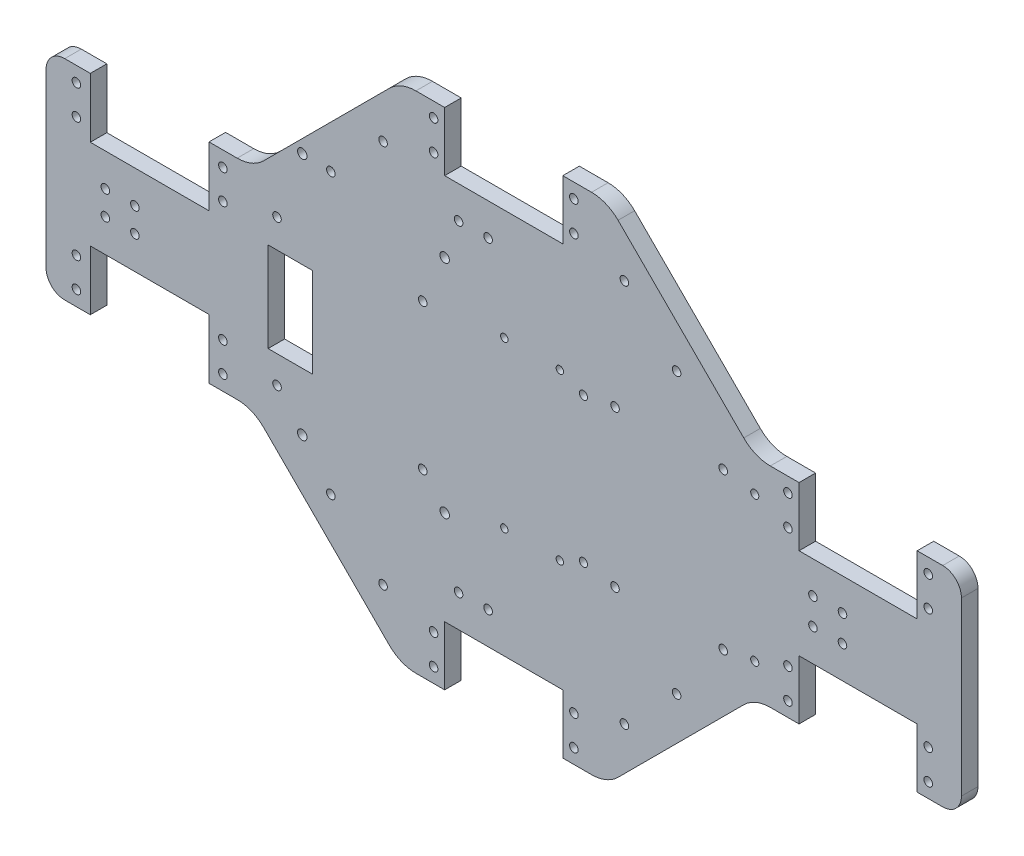
from build123d import *

# Parameters (mm, degrees)
BOSS_EXTRU_1_DEPTH       = 5.6
ENL_V_MAT_EXTRU_1_REACH  = 323.597
ESQUISSE2_W              = 40.2
ESQUISSE2_H              = 20.2
ENL_V_MAT_EXTRU_2_REACH  = 323.597
ESQUISSE3_R              = 1.45
SKETCH2_W                = 40
SKETCH2_H                = 20
CUT_EXTRUDE2_DEPTH       = 322.596828343
SKETCH5_R                = 1.45
CUT_EXTRUDE4_DEPTH       = 322.596828343
ESQUISSE4_R              = 1.375
ENL_V_MAT_EXTRU_4_DEPTH  = 322.596828343
ESQUISSE6_R              = 1.45
ENL_V_MAT_EXTRU_6_DEPTH  = 322.596828343
ESQUISSE8_R              = 1.25
ENL_V_MAT_EXTRU_7_DEPTH  = 322.596828343
ESQUISSE9_R              = 1.6
ENL_V_MAT_EXTRU_8_DEPTH  = 322.596828343
SKETCH6_W                = 15
SKETCH6_H                = 30.4
CUT_EXTRUDE5_DEPTH       = 10
ESQUISSE12_R             = 1.45
ENL_V_MAT_EXTRU_11_DEPTH = 322.596828343
FILLET1_R                = 6.35
FILLET2_R                = 12.7
SKETCH8_R                = 1.45
CUT_EXTRUDE7_DEPTH       = 322.596828343


with BuildPart() as part:
    # Esquisse1 → Boss.-Extru.1 (new body)
    with BuildSketch(Plane.XY):
        Polygon((70, -35.4), (120, -85.4), (190, -85.4), (240, -35.4), (310, -35.4), (310, 0), (25.838605695, 0), (0, 0), (0, -35.4), align=None)
    boss_extru_1 = extrude(amount=BOSS_EXTRU_1_DEPTH)

    # Esquisse2 → Enlèv. mat.-Extru.1 (cut, up to next)
    with BuildSketch(Plane.XY.offset(5.6), mode=Mode.PRIVATE) as enl_v_mat_extru_1_sk1:
        with Locations((35.1, -25.3)):
            Rectangle(ESQUISSE2_W, ESQUISSE2_H)
    enl_v_mat_extru_1_tool1 = extrude(enl_v_mat_extru_1_sk1.sketch, amount=-ENL_V_MAT_EXTRU_1_REACH, mode=Mode.PRIVATE) & part.part
    enl_v_mat_extru_1 = enl_v_mat_extru_1_tool1.solids().sort_by_distance((35.1, -25.3, 5.6))[0]
    add(enl_v_mat_extru_1, mode=Mode.SUBTRACT)

    # Esquisse3 → Enlèv. mat.-Extru.2 (cut, up to next)
    with BuildSketch(Plane.XY.offset(5.6), mode=Mode.PRIVATE) as enl_v_mat_extru_2_sk1:
        with Locations((10.3, -30.3)):
            Circle(ESQUISSE3_R)
    enl_v_mat_extru_2_tool1 = extrude(enl_v_mat_extru_2_sk1.sketch, amount=-ENL_V_MAT_EXTRU_2_REACH, mode=Mode.PRIVATE) & part.part
    # Esquisse3 → Enlèv. mat.-Extru.2 (cut, up to next)
    with BuildSketch(Plane.XY.offset(5.6), mode=Mode.PRIVATE) as enl_v_mat_extru_2_sk2:
        with Locations((59.9, -30.3)):
            Circle(ESQUISSE3_R)
    enl_v_mat_extru_2_tool2 = extrude(enl_v_mat_extru_2_sk2.sketch, amount=-ENL_V_MAT_EXTRU_2_REACH, mode=Mode.PRIVATE) & part.part
    # Esquisse3 → Enlèv. mat.-Extru.2 (cut, up to next)
    with BuildSketch(Plane.XY.offset(5.6), mode=Mode.PRIVATE) as enl_v_mat_extru_2_sk3:
        with Locations((59.9, -20.3)):
            Circle(ESQUISSE3_R)
    enl_v_mat_extru_2_tool3 = extrude(enl_v_mat_extru_2_sk3.sketch, amount=-ENL_V_MAT_EXTRU_2_REACH, mode=Mode.PRIVATE) & part.part
    # Esquisse3 → Enlèv. mat.-Extru.2 (cut, up to next)
    with BuildSketch(Plane.XY.offset(5.6), mode=Mode.PRIVATE) as enl_v_mat_extru_2_sk4:
        with Locations((10.3, -20.3)):
            Circle(ESQUISSE3_R)
    enl_v_mat_extru_2_tool4 = extrude(enl_v_mat_extru_2_sk4.sketch, amount=-ENL_V_MAT_EXTRU_2_REACH, mode=Mode.PRIVATE) & part.part
    # Esquisse3 → Enlèv. mat.-Extru.2 (cut, up to next)
    with BuildSketch(Plane.XY.offset(5.6), mode=Mode.PRIVATE) as enl_v_mat_extru_2_sk5:
        with Locations((20.1, -4.1)):
            Circle(ESQUISSE3_R)
    enl_v_mat_extru_2_tool5 = extrude(enl_v_mat_extru_2_sk5.sketch, amount=-ENL_V_MAT_EXTRU_2_REACH, mode=Mode.PRIVATE) & part.part
    # Esquisse3 → Enlèv. mat.-Extru.2 (cut, up to next)
    with BuildSketch(Plane.XY.offset(5.6), mode=Mode.PRIVATE) as enl_v_mat_extru_2_sk6:
        with Locations((30.1, -4.1)):
            Circle(ESQUISSE3_R)
    enl_v_mat_extru_2_tool6 = extrude(enl_v_mat_extru_2_sk6.sketch, amount=-ENL_V_MAT_EXTRU_2_REACH, mode=Mode.PRIVATE) & part.part
    enl_v_mat_extru_2_1 = enl_v_mat_extru_2_tool1.solids().sort_by_distance((10.3, -30.3, 5.6))[0]
    add(enl_v_mat_extru_2_1, mode=Mode.SUBTRACT)
    enl_v_mat_extru_2_2 = enl_v_mat_extru_2_tool2.solids().sort_by_distance((59.9, -30.3, 5.6))[0]
    add(enl_v_mat_extru_2_2, mode=Mode.SUBTRACT)
    enl_v_mat_extru_2_3 = enl_v_mat_extru_2_tool3.solids().sort_by_distance((59.9, -20.3, 5.6))[0]
    add(enl_v_mat_extru_2_3, mode=Mode.SUBTRACT)
    enl_v_mat_extru_2_4 = enl_v_mat_extru_2_tool4.solids().sort_by_distance((10.3, -20.3, 5.6))[0]
    add(enl_v_mat_extru_2_4, mode=Mode.SUBTRACT)
    enl_v_mat_extru_2_5 = enl_v_mat_extru_2_tool5.solids().sort_by_distance((20.1, -4.1, 5.6))[0]
    add(enl_v_mat_extru_2_5, mode=Mode.SUBTRACT)
    enl_v_mat_extru_2_6 = enl_v_mat_extru_2_tool6.solids().sort_by_distance((30.1, -4.1, 5.6))[0]
    add(enl_v_mat_extru_2_6, mode=Mode.SUBTRACT)
    enl_v_mat_extru_2 = enl_v_mat_extru_2_1 + enl_v_mat_extru_2_2 + enl_v_mat_extru_2_3 + enl_v_mat_extru_2_4 + enl_v_mat_extru_2_5 + enl_v_mat_extru_2_6  # Enlèv. mat.-Extru.2 as one shape, for the pattern or mirror that repeats it

    # Sketch2 → Cut-Extrude2 (cut, symmetric)
    with BuildSketch(Plane.XY):
        with Locations((275, -25.4)):
            Rectangle(SKETCH2_W, SKETCH2_H)
        with Locations((155, -75.4)):
            Rectangle(SKETCH2_W, SKETCH2_H)
    cut_extrude2 = extrude(amount=CUT_EXTRUDE2_DEPTH, both=True, mode=Mode.SUBTRACT)

    # Sketch5 → Cut-Extrude4 (cut, through all)
    with BuildSketch(Plane.XY):
        with Locations((131.25, -80.48)):
            Circle(SKETCH5_R)
        with Locations((178.75, -80.48)):
            Circle(SKETCH5_R)
        with Locations(Location((178.75, -70.32, 0), (0, 0, 180))):
            Circle(SKETCH5_R)
        with Locations(Location((131.25, -70.32, 0), (0, 0, 180))):
            Circle(SKETCH5_R)
        with Locations((251.25, -30.48)):
            Circle(SKETCH5_R)
        with Locations((298.75, -30.48)):
            Circle(SKETCH5_R)
        with Locations(Location((298.75, -20.32, 0), (0, 0, 180))):
            Circle(SKETCH5_R)
        with Locations(Location((251.25, -20.32, 0), (0, 0, 180))):
            Circle(SKETCH5_R)
        with Locations((139.712, -54.49)):
            Circle(SKETCH5_R)
        with Locations((149.712, -54.49)):
            Circle(SKETCH5_R)
        with Locations((259.712, -4.49)):
            Circle(SKETCH5_R)
        with Locations((269.712, -4.49)):
            Circle(SKETCH5_R)
    cut_extrude4 = extrude(amount=CUT_EXTRUDE4_DEPTH, mode=Mode.SUBTRACT)

    # Mirror1: Boss.-Extru.1, Enlèv. mat.-Extru.1, Enlèv. mat.-Extru.2, Cut-Extrude2, Cut-Extrude4 across plane
    add(boss_extru_1.mirror(Plane.ZX))
    add(enl_v_mat_extru_1.mirror(Plane.ZX), mode=Mode.SUBTRACT)
    add(enl_v_mat_extru_2.mirror(Plane.ZX), mode=Mode.SUBTRACT)
    add(cut_extrude2.mirror(Plane.ZX), mode=Mode.SUBTRACT)
    add(cut_extrude4.mirror(Plane.ZX), mode=Mode.SUBTRACT)

    # Esquisse4 → Enlèv. mat.-Extru.4 (cut, through all)
    with BuildSketch(Plane.XY.offset(5.6)):
        with Locations((182, -24.5)):
            Circle(ESQUISSE4_R)
        with Locations((240, -24.5)):
            Circle(ESQUISSE4_R)
        with Locations((240, 24.5)):
            Circle(ESQUISSE4_R)
        with Locations((182, 24.5)):
            Circle(ESQUISSE4_R)
    extrude(amount=-ENL_V_MAT_EXTRU_4_DEPTH, mode=Mode.SUBTRACT)

    # Esquisse6 → Enlèv. mat.-Extru.6 (cut, through all)
    with BuildSketch(Plane(origin=(0, 0, 0), x_dir=(-1, 0, 0), z_dir=(0, 0, -1))):
        with Locations((-192.685, -26.415)):
            Circle(ESQUISSE6_R)
        with Locations((-229.315, -26.415)):
            Circle(ESQUISSE6_R)
        with Locations((-229.315, 26.415)):
            Circle(ESQUISSE6_R)
        with Locations((-192.685, 26.415)):
            Circle(ESQUISSE6_R)
    extrude(amount=-ENL_V_MAT_EXTRU_6_DEPTH, mode=Mode.SUBTRACT)

    # Esquisse8 → Enlèv. mat.-Extru.7 (cut, through all)
    with BuildSketch(Plane(origin=(0, 0, 0), x_dir=(-1, 0, 0), z_dir=(0, 0, -1))):
        with Locations((-155.2, 27.95)):
            Circle(ESQUISSE8_R)
        with Locations((-174, 27.95)):
            Circle(ESQUISSE8_R)
        with Locations((-174, -27.95)):
            Circle(ESQUISSE8_R)
        with Locations((-155.2, -27.95)):
            Circle(ESQUISSE8_R)
    extrude(amount=-ENL_V_MAT_EXTRU_7_DEPTH, mode=Mode.SUBTRACT)

    # Esquisse9 → Enlèv. mat.-Extru.8 (cut, through all)
    with BuildSketch(Plane(origin=(0, 0, 0), x_dir=(-1, 0, 0), z_dir=(0, 0, -1))):
        with Locations((-135, -33.48)):
            Circle(ESQUISSE9_R)
        with Locations((-86.78, -34.71)):
            Circle(ESQUISSE9_R)
        with Locations((-86.78, 47.76)):
            Circle(ESQUISSE9_R)
        with Locations((-135, 41.4)):
            Circle(ESQUISSE9_R)
    extrude(amount=-ENL_V_MAT_EXTRU_8_DEPTH, mode=Mode.SUBTRACT)

    # Sketch6 → Cut-Extrude5 (cut)
    with BuildSketch(Plane.XY.offset(5.6)):
        with Locations((82.7, 0)):
            Rectangle(SKETCH6_W, SKETCH6_H)
    extrude(amount=-CUT_EXTRUDE5_DEPTH, mode=Mode.SUBTRACT)

    # Esquisse12 → Enlèv. mat.-Extru.11 (cut, through all)
    with BuildSketch(Plane.XY.offset(5.6)):
        with Locations((114.142135624, 65)):
            Circle(ESQUISSE12_R)
        with Locations((96.464466094, 47.32233047)):
            Circle(ESQUISSE12_R)
        with Locations(Location((213.535533906, 47.32233047, 0), (0, 0, 180))):
            Circle(ESQUISSE12_R)
        with Locations(Location((195.857864376, 65, 0), (0, 0, 180))):
            Circle(ESQUISSE12_R)
        with Locations((213.535533906, -47.32233047)):
            Circle(ESQUISSE12_R)
        with Locations((195.857864376, -65)):
            Circle(ESQUISSE12_R)
        with Locations(Location((114.142135624, -65, 0), (0, 0, 180))):
            Circle(ESQUISSE12_R)
        with Locations(Location((96.464466094, -47.32233047, 0), (0, 0, 180))):
            Circle(ESQUISSE12_R)
    extrude(amount=-ENL_V_MAT_EXTRU_11_DEPTH, mode=Mode.SUBTRACT)

    # Fillet1
    fillet1_edges = [part.edges().sort_by_distance(p)[0] for p in [
        (0, 35.4, 2.8),
        (310, 35.4, 2.8),
        (0, -35.4, 2.8),
        (310, -35.4, 2.8),
    ]]
    fillet(fillet1_edges, radius=FILLET1_R)

    # Fillet2
    fillet2_edges = [part.edges().sort_by_distance(p)[0] for p in [
        (70, 35.4, 2.8),
        (240, 35.4, 2.8),
        (190, 85.4, 2.8),
        (120, 85.4, 2.8),
        (240, -35.4, 2.8),
        (190, -85.4, 2.8),
        (120, -85.4, 2.8),
        (70, -35.4, 2.8),
    ]]
    fillet(fillet2_edges, radius=FILLET2_R)

    # Sketch8 → Cut-Extrude7 (cut, through all)
    with BuildSketch(Plane.XY.offset(5.6)):
        with Locations((78.226689569, 24.875)):
            Circle(SKETCH8_R)
        with Locations((127.576689569, 24.875)):
            Circle(SKETCH8_R)
        with Locations((127.576689569, -24.475)):
            Circle(SKETCH8_R)
        with Locations((78.226689569, -24.475)):
            Circle(SKETCH8_R)
    extrude(amount=-CUT_EXTRUDE7_DEPTH, mode=Mode.SUBTRACT)


solid = part.part
